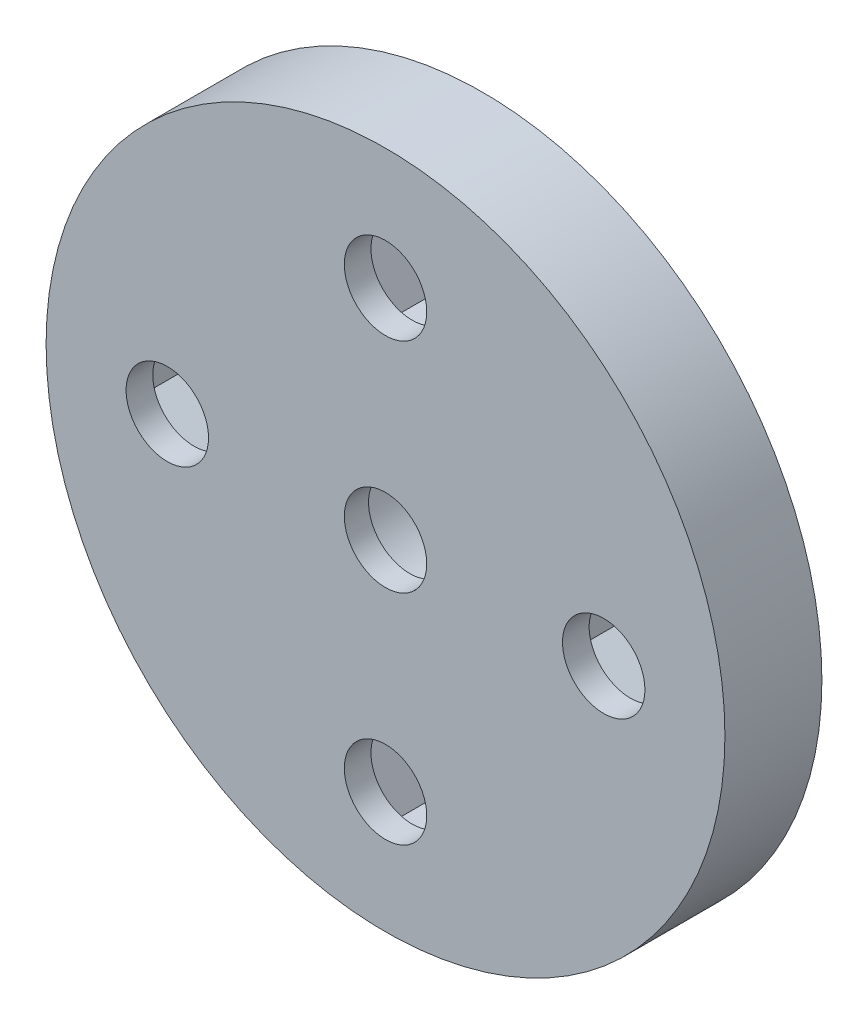
from build123d import *

# Parameters (mm, degrees)
HUB_DISC_OD28_THICKNESS4_PROFILE_R            = 14
HUB_DISC_OD28_THICKNESS4_DEPTH                = 4
MG996R_SPLINE_PRESS_SOCKET_D5P80_DEP_2_R      = 2.9
MG996R_SPLINE_PRESS_SOCKET_D5P80_DEPTH3_DEPTH = 3
M3_CENTRE_SCREW_CLEARANCE_THROUGH_FLOOR_START = -50
M3_CENTRE_SCREW_CLEARANCE_THROUGH_FL_2_R      = 1.7
M3_CENTRE_SCREW_CLEARANCE_THROUGH_FLOOR_DEPTH = 71.199009877
LINK_M3_CLEARANCE_PCD18_START                 = -50
LINK_M3_CLEARANCE_PCD18_PROFILE_R             = 1.7
LINK_M3_CLEARANCE_PCD18_DEPTH                 = 71.199009877
CAPTURED_M3_NUT_POCKETS_DEPTH2P9_DEPTH        = 2.9


with BuildPart() as part:
    # Hub_disc_OD28_thickness4_profile → Hub_disc_OD28_thickness4 (new body)
    with BuildSketch(Plane.XY):
        Circle(HUB_DISC_OD28_THICKNESS4_PROFILE_R)
    extrude(amount=HUB_DISC_OD28_THICKNESS4_DEPTH)

    # MG996R_spline_press_socket_D5p80_dep 2 → MG996R_spline_press_socket_D5p80_depth3 (cut)
    with BuildSketch(Plane.XY):
        Circle(MG996R_SPLINE_PRESS_SOCKET_D5P80_DEP_2_R)
    extrude(amount=MG996R_SPLINE_PRESS_SOCKET_D5P80_DEPTH3_DEPTH, mode=Mode.SUBTRACT)

    # M3_centre_screw_clearance_through_fl 2 → M3_centre_screw_clearance_through_floor (cut, through all)
    with BuildSketch(Plane.XY.offset(M3_CENTRE_SCREW_CLEARANCE_THROUGH_FLOOR_START)):
        Circle(M3_CENTRE_SCREW_CLEARANCE_THROUGH_FL_2_R)
    extrude(amount=M3_CENTRE_SCREW_CLEARANCE_THROUGH_FLOOR_DEPTH, mode=Mode.SUBTRACT)

    # Link_M3_clearance_PCD18_profile → Link_M3_clearance_PCD18 (cut, through all)
    with BuildSketch(Plane.XY.offset(LINK_M3_CLEARANCE_PCD18_START)):
        with Locations((9, 0)):
            Circle(LINK_M3_CLEARANCE_PCD18_PROFILE_R)
        with Locations((0, 9)):
            Circle(LINK_M3_CLEARANCE_PCD18_PROFILE_R)
        with Locations((-9, 0)):
            Circle(LINK_M3_CLEARANCE_PCD18_PROFILE_R)
        with Locations((0, -9)):
            Circle(LINK_M3_CLEARANCE_PCD18_PROFILE_R)
    extrude(amount=LINK_M3_CLEARANCE_PCD18_DEPTH, mode=Mode.SUBTRACT)

    # Captured_M3_nut_pockets_AF5p7_profile → Captured_M3_nut_pockets_depth2p9 (cut)
    with BuildSketch(Plane.XY):
        Polygon((11.85, 1.645448267), (9, 3.290896534), (6.15, 1.645448267), (6.15, -1.645448267), (9, -3.290896534), (11.85, -1.645448267), align=None)
        Polygon((-1.645448267, 11.85), (-3.290896534, 9), (-1.645448267, 6.15), (1.645448267, 6.15), (3.290896534, 9), (1.645448267, 11.85), align=None)
        Polygon((-11.85, -1.645448267), (-9, -3.290896534), (-6.15, -1.645448267), (-6.15, 1.645448267), (-9, 3.290896534), (-11.85, 1.645448267), align=None)
        Polygon((1.645448267, -11.85), (3.290896534, -9), (1.645448267, -6.15), (-1.645448267, -6.15), (-3.290896534, -9), (-1.645448267, -11.85), align=None)
    extrude(amount=CAPTURED_M3_NUT_POCKETS_DEPTH2P9_DEPTH, mode=Mode.SUBTRACT)


solid = part.part
